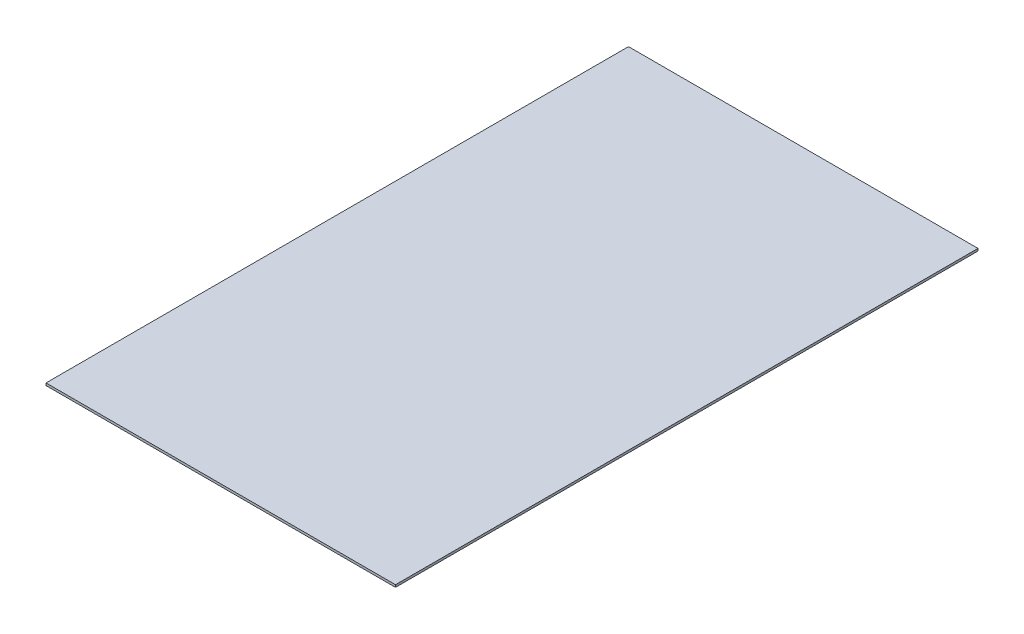
from build123d import *

# Parameters (mm, degrees)
SKETCH1_W           = 30
SKETCH1_H           = 50
BOSS_EXTRUDE1_DEPTH = 0.2


with BuildPart() as part:
    # Sketch1 → Boss-Extrude1 (new body)
    with BuildSketch(Plane(origin=(0, 0, 0), x_dir=(1, 0, 0), z_dir=(0, 1, 0))):
        with Locations((-15, 25)):
            Rectangle(SKETCH1_W, SKETCH1_H)
    extrude(amount=BOSS_EXTRUDE1_DEPTH)


solid = part.part
